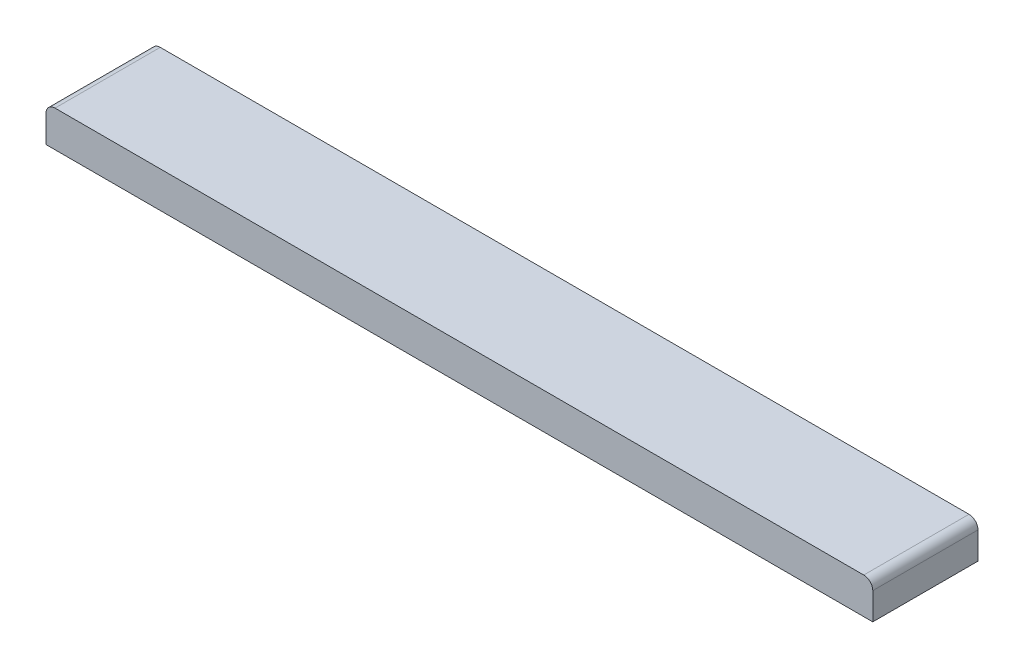
from build123d import *

# Parameters (mm, degrees)
SKETCH_1_W      = 275
SKETCH_1_H      = 35
EXTRUDE_1_DEPTH = 12
FILLET_1_R      = 3


with BuildPart() as part:
    # 草图1 → 凸台-拉伸1 (new body)
    with BuildSketch(Plane(origin=(0, 0, 0), x_dir=(1, 0, 0), z_dir=(0, 1, 0))):
        Rectangle(SKETCH_1_W, SKETCH_1_H)
    extrude(amount=EXTRUDE_1_DEPTH)

    # 圆角1
    fillet_1_edges = [part.edges().sort_by_distance(p)[0] for p in [
        (-137.5, 12, 0),
        (137.5, 12, 0),
    ]]
    fillet(fillet_1_edges, radius=FILLET_1_R)


solid = part.part
